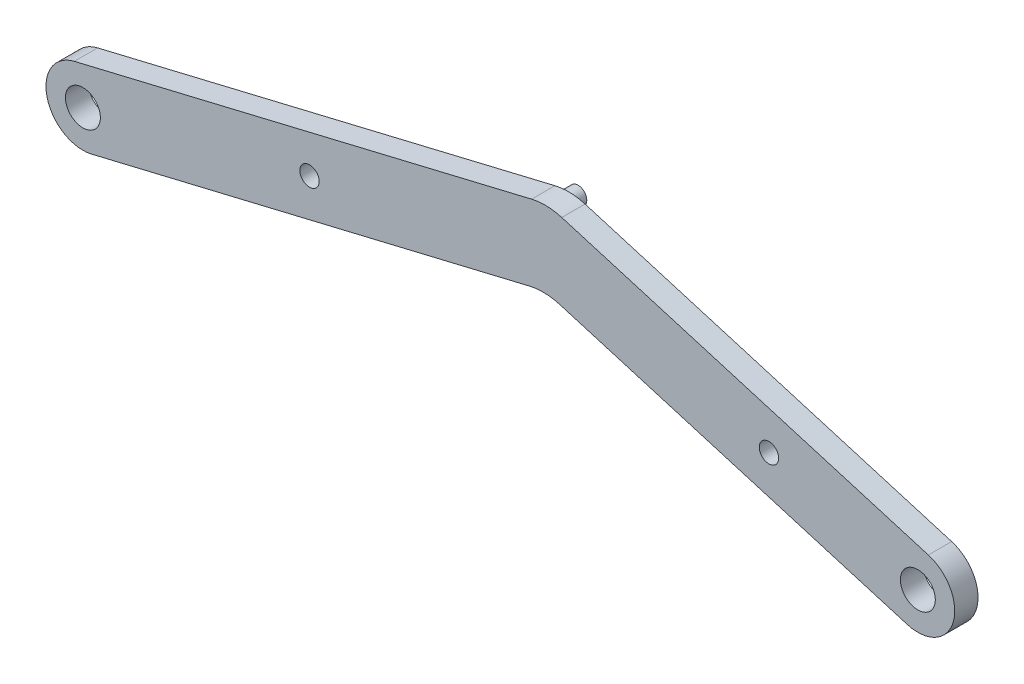
from build123d import *

# Parameters (mm, degrees)
CROQUIS1_R              = 9
SALIENTE_EXTRUIR1_DEPTH = 12
REDONDEO1_R             = 30
CROQUIS2_R              = 5
CORTAR_EXTRUIR1_DEPTH   = 256.746915224
CROQUIS3_R              = 4.5
SALIENTE_EXTRUIR2_DEPTH = 12


with BuildPart() as part:
    # Croquis1 → Saliente-Extruir1 (new body)
    with BuildSketch(Plane.XY):
        with BuildLine():
            Line((24.517509814, 102.154502749), (221.020251881, 43.73046074))
            ThreePointArc((221.020251881, 43.73046074), (233.817531659, 20.103577105), (210.190648025, 7.306297327))
            Line((210.190648025, 7.306297327), (23.447731129, 62.828555729))
            Line((23.447731129, 62.828555729), (-209.97786522, 7.038852656))
            ThreePointArc((-209.97786522, 7.038852656), (-232.874076425, 21.101694207), (-218.811234874, 43.997905411))
            Line((-218.811234874, 43.997905411), (24.517509814, 102.154502749))
        make_face()
        with Locations((-214.394550047, 25.518379034)):
            Circle(CROQUIS1_R, mode=Mode.SUBTRACT)
        with Locations((215.605449953, 25.518379034)):
            Circle(CROQUIS1_R, mode=Mode.SUBTRACT)
    extrude(amount=SALIENTE_EXTRUIR1_DEPTH)

    # Redondeo1
    redondeo1_edges = [part.edges().sort_by_distance(p)[0] for p in [
        (23.447731129, 62.828555729, 6),
        (24.517509814, 102.154502749, 6),
    ]]
    fillet(redondeo1_edges, radius=REDONDEO1_R)

    # Croquis2 → Cortar-Extruir1 (cut, through all)
    with BuildSketch(Plane.XY.offset(12)):
        with Locations((138.923000663, 48.317545048)):
            Circle(CROQUIS2_R)
        with Locations((-97.681751872, 53.41323057)):
            Circle(CROQUIS2_R)
    extrude(amount=-CORTAR_EXTRUIR1_DEPTH, mode=Mode.SUBTRACT)

    # Croquis3 → Saliente-Extruir2 (add)
    with BuildSketch(Plane(origin=(0, 0, 0), x_dir=(-1, 0, 0), z_dir=(0, 0, -1))):
        with Locations(Location((-16.610214781, 89.982977062, 0), (0, 0, 180))):
            Circle(CROQUIS3_R)
    extrude(amount=SALIENTE_EXTRUIR2_DEPTH)


solid = part.part
